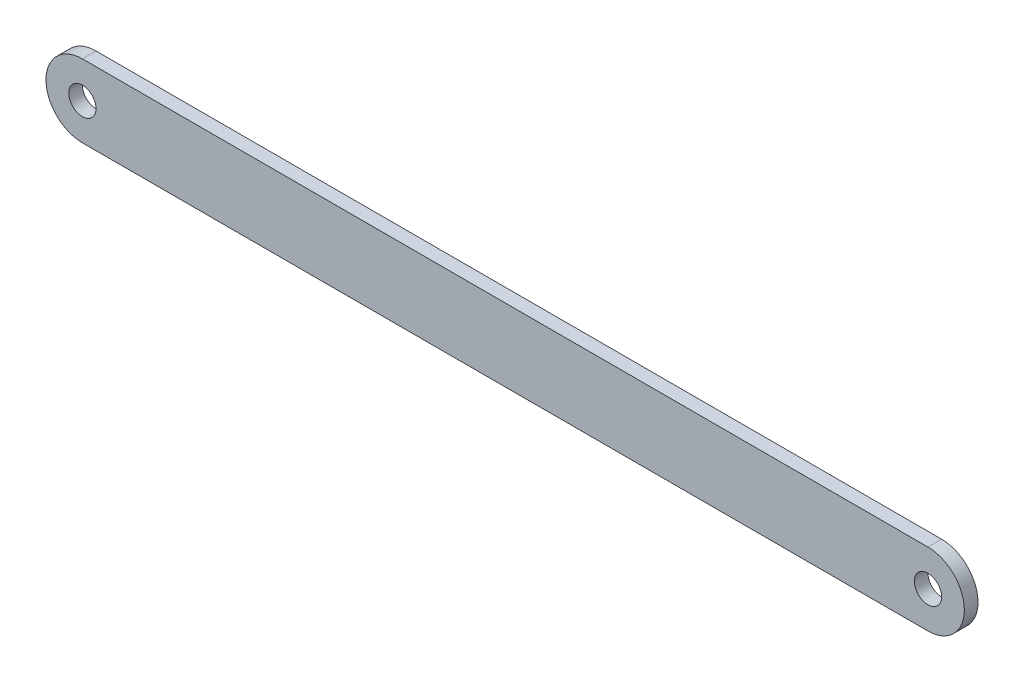
from build123d import *

# Parameters (mm, degrees)
SKETCH_1_R      = 8
SKETCH_1_R_2    = 3
EXTRUDE_1_DEPTH = 3


with BuildPart() as part:
    # 草图1 → 凸台-拉伸1 (new body)
    # profile 1 of 3: a face of its own
    with BuildSketch(Plane.XY):
        with BuildLine():
            Line((92.999999991, 8), (-93, 8))
            ThreePointArc((-93, 8), (-87.343145751, 5.656854249), (-85, 0))
            ThreePointArc((-85, 0), (-87.343145751, -5.656854249), (-93, -8))
            Line((-93, -8), (93.000000101, -8))
            ThreePointArc((93.000000101, -8), (85, -5.5e-08), (92.999999991, 8))
        make_face()
    # profile 2 of 3: a face of its own
    with BuildSketch(Plane.XY):
        with Locations((-93, 0)):
            Circle(SKETCH_1_R)
        with Locations((-93, 0)):
            Circle(SKETCH_1_R_2, mode=Mode.SUBTRACT)
    # profile 3 of 3: a face of its own
    with BuildSketch(Plane.XY):
        with Locations((93, 0)):
            Circle(SKETCH_1_R)
        with Locations((93, 0)):
            Circle(SKETCH_1_R_2, mode=Mode.SUBTRACT)
    extrude(amount=EXTRUDE_1_DEPTH)


solid = part.part
